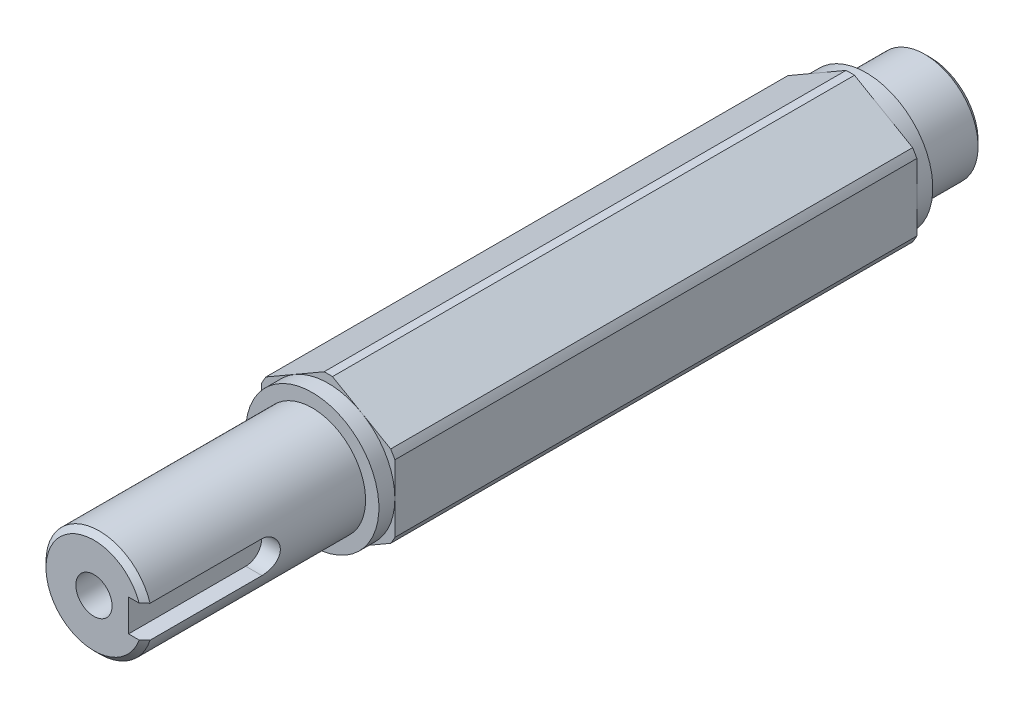
from build123d import *

# Parameters (mm, degrees)
BOSS_EXTRUDE1_DEPTH             = 49
CHAMFER1_SIZE                   = 1
M8_TAPPED_HOLE1_D               = 6.8
M8_TAPPED_HOLE1_DEPTH           = 19.75
M8_TAPPED_HOLE1_TIP             = 2.042926105
M8_TAPPED_HOLE1_ON_FACE_2_D     = 6.8
M8_TAPPED_HOLE1_ON_FACE_2_DEPTH = 19.75
M8_TAPPED_HOLE1_ON_FACE_2_TIP   = 2.042926105
CUT_EXTRUDE1_START              = 10
CUT_EXTRUDE1_DEPTH              = 3.5


with BuildPart() as part:
    # Sketch1 → Boss-Extrude1 (new, symmetric)
    with BuildSketch(Plane.XY):
        with BuildLine():
            ThreePointArc((0.789917583, 13.977697601), (0, 14), (-0.789917583, 13.977697601))
            Line((-0.789917583, 13.977697601), (-11.710082417, 7.672937494))
            ThreePointArc((-11.710082417, 7.672937494), (-12.124355653, 7), (-12.5, 6.304760106))
            Line((-12.5, 6.304760106), (-12.5, -6.304760106))
            ThreePointArc((-12.5, -6.304760106), (-12.124355653, -7), (-11.710082417, -7.672937494))
            Line((-11.710082417, -7.672937494), (-0.789917583, -13.977697601))
            ThreePointArc((-0.789917583, -13.977697601), (0, -14), (0.789917583, -13.977697601))
            Line((0.789917583, -13.977697601), (11.710082417, -7.672937494))
            ThreePointArc((11.710082417, -7.672937494), (12.124355653, -7), (12.5, -6.304760106))
            Line((12.5, -6.304760106), (12.5, 6.304760106))
            ThreePointArc((12.5, 6.304760106), (12.124355653, 7), (11.710082417, 7.672937494))
            Line((11.710082417, 7.672937494), (0.789917583, 13.977697601))
        make_face()
    extrude(amount=BOSS_EXTRUDE1_DEPTH, both=True)

    # Sketch2 → Revolve1 (revolve)
    with BuildSketch(Plane(origin=(0, 0, 0), x_dir=(0, 0, -1), z_dir=(1, 0, 0)), mode=Mode.PRIVATE) as revolve1_sk:
        Polygon((-93, 0), (-93, 10), (-52, 10), (-52, 12.5), (-49, 12.5), (-49, 0), align=None)
        Polygon((52, 10), (64, 10), (64, 0), (49, 0), (49, 12.5), (52, 12.5), align=None)
    revolve(revolve1_sk.sketch.rotate(Axis((0, 0, -70.752525622), (0, 0, 1)), 90), axis=Axis((0, 0, -70.752525622), (0, 0, 1)))

    # Chamfer1
    chamfer1_edges = [part.edges().sort_by_distance(p)[0] for p in [
        (10, 0, 93),
        (10, 0, -64),
    ]]
    chamfer(chamfer1_edges, length=CHAMFER1_SIZE)

    # M8 Tapped Hole1
    with Locations(Plane.XY.offset(93)):
        with Locations((0, 0)):
            Hole(M8_TAPPED_HOLE1_D / 2, depth=M8_TAPPED_HOLE1_DEPTH)
            with Locations((0, 0, -(M8_TAPPED_HOLE1_DEPTH + M8_TAPPED_HOLE1_TIP / 2))):  # 118° drill point
                Cone(0, M8_TAPPED_HOLE1_D / 2, M8_TAPPED_HOLE1_TIP, mode=Mode.SUBTRACT)

    # M8 Tapped Hole1 on face 2
    with Locations(Plane(origin=(0, 0, -64), x_dir=(-1, 0, 0), z_dir=(0, 0, -1))):
        with Locations((0, 0)):
            Hole(M8_TAPPED_HOLE1_ON_FACE_2_D / 2, depth=M8_TAPPED_HOLE1_ON_FACE_2_DEPTH)
            with Locations((0, 0, -(M8_TAPPED_HOLE1_ON_FACE_2_DEPTH + M8_TAPPED_HOLE1_ON_FACE_2_TIP / 2))):  # 118° drill point
                Cone(0, M8_TAPPED_HOLE1_ON_FACE_2_D / 2, M8_TAPPED_HOLE1_ON_FACE_2_TIP, mode=Mode.SUBTRACT)

    # Sketch4 → Cut-Extrude1 (cut)
    with BuildSketch(Plane(origin=(0, 0, 0), x_dir=(0, 0, -1), z_dir=(1, 0, 0)).offset(CUT_EXTRUDE1_START)):
        with BuildLine():
            Line((-93, -3), (-71, -3))
            ThreePointArc((-71, -3), (-68, 0), (-71, 3))
            Line((-71, 3), (-93, 3))
            ThreePointArc((-93, 3), (-96, 0), (-93, -3))
        make_face()
    extrude(amount=-CUT_EXTRUDE1_DEPTH, mode=Mode.SUBTRACT)


solid = part.part
